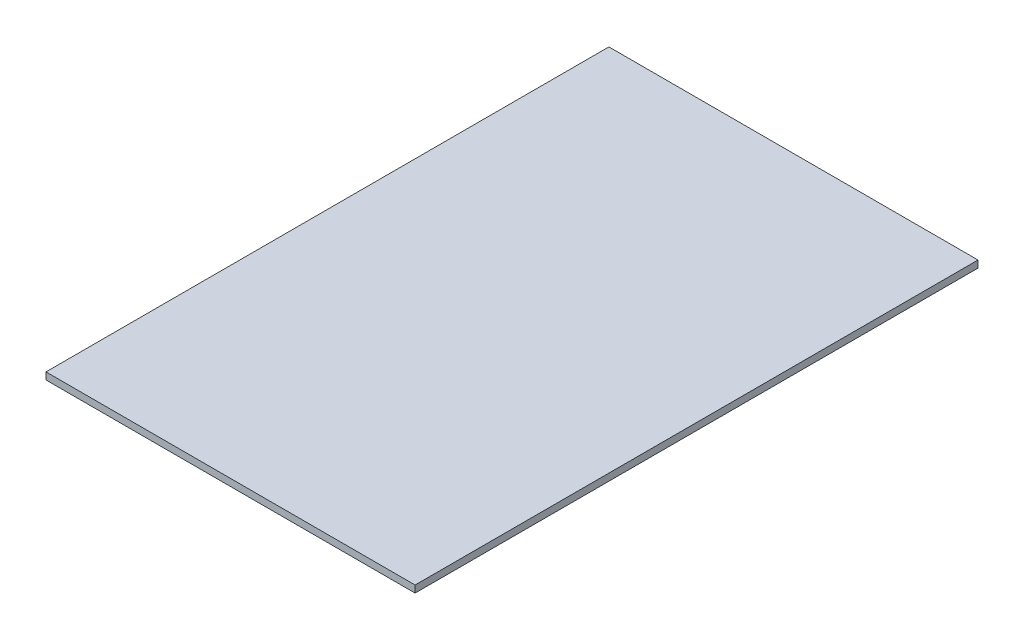
from build123d import *

# Parameters (mm, degrees)
SKETCH1_W           = 500
SKETCH1_H           = 762.5
BOSS_EXTRUDE1_DEPTH = 9.525


with BuildPart() as part:
    # Sketch1 → Boss-Extrude1 (new body)
    with BuildSketch(Plane(origin=(0, 0, 0), x_dir=(1, 0, 0), z_dir=(0, 1, 0))):
        with Locations((250, 381.25)):
            Rectangle(SKETCH1_W, SKETCH1_H)
    extrude(amount=BOSS_EXTRUDE1_DEPTH)


solid = part.part
